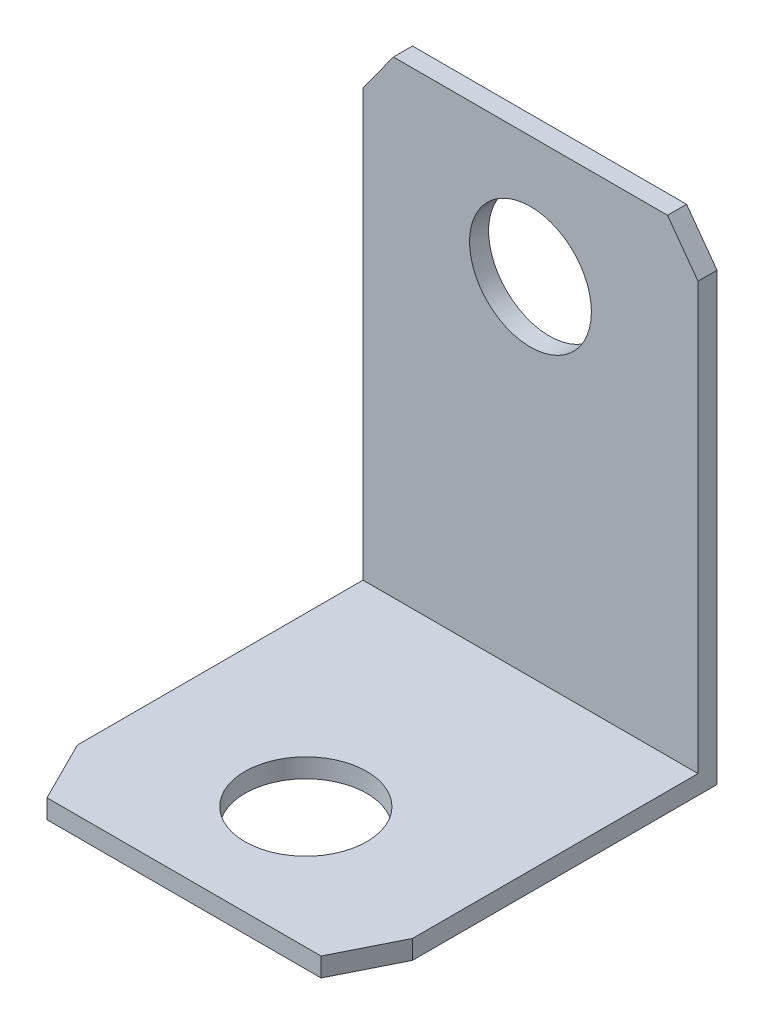
from build123d import *

# Parameters (mm, degrees)
SKETCH1_R           = 6.35
BOSS_EXTRUDE1_DEPTH = 1.984375
SKETCH2_R           = 6.35
BOSS_EXTRUDE2_DEPTH = 1.984375


with BuildPart() as part:
    # Sketch1 → Boss-Extrude1 (new body)
    with BuildSketch(Plane(origin=(0, 0, 0), x_dir=(1, 0, 0), z_dir=(0, 1, 0))):
        Polygon((0, 0), (34.925, 0), (34.925, -31.75), (31.75, -38.1), (3.175, -38.1), (0, -31.75), align=None)
        with Locations(Location((17.4625, -25.4, 0), (0, 0, 270))):
            Circle(SKETCH1_R, mode=Mode.SUBTRACT)
    extrude(amount=BOSS_EXTRUDE1_DEPTH)

    # Sketch2 → Boss-Extrude2 (add)
    with BuildSketch(Plane.XY):
        Polygon((0, 1.984375), (0, 46.434375), (3.175, 50.8), (31.75, 50.8), (34.925, 46.434375), (34.925, 1.984375), align=None)
        with Locations((17.4625, 38.1)):
            Circle(SKETCH2_R, mode=Mode.SUBTRACT)
    extrude(amount=BOSS_EXTRUDE2_DEPTH)


solid = part.part
